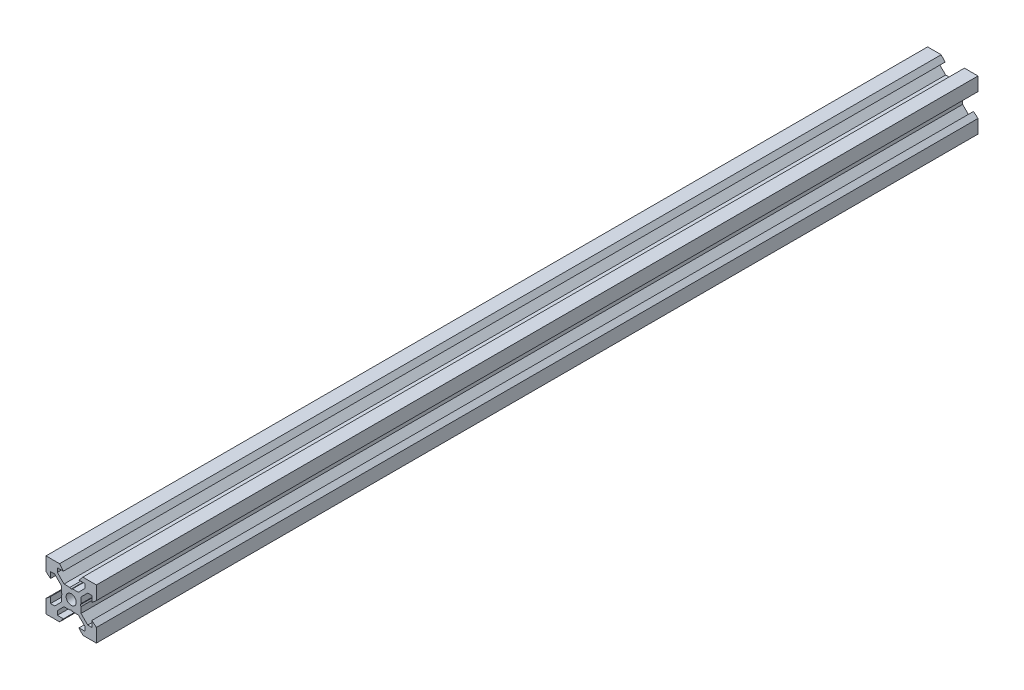
from build123d import *

# Parameters (mm, degrees)
SKETCH1_R           = 2
BOSS_EXTRUDE1_DEPTH = 175


with BuildPart() as part:
    # Sketch1 → Boss-Extrude1 (new, symmetric)
    with BuildSketch(Plane.XY):
        Polygon((10, 10), (10, 4.610379336), (8.2, 3.1), (8.2, 5.5), (6.560660172, 5.5), (3.9, 2.839339828), (3.9, 0.519615242), (3.6, 0), (3.9, -0.519615242), (3.9, -2.839339828), (6.560660172, -5.5), (8.2, -5.5), (8.2, -3.1), (10, -4.610379336), (10, -10), (4.610379336, -10), (3.1, -8.2), (5.5, -8.2), (5.5, -6.560660172), (2.839339828, -3.9), (0.519615242, -3.9), (0, -3.6), (-0.519615242, -3.9), (-2.839339828, -3.9), (-5.5, -6.560660172), (-5.5, -8.2), (-3.1, -8.2), (-4.610379336, -10), (-10, -10), (-10, -4.610379336), (-8.2, -3.1), (-8.2, -5.5), (-6.560660172, -5.5), (-3.9, -2.839339828), (-3.9, -0.519615242), (-3.6, 0), (-3.9, 0.519615242), (-3.9, 2.839339828), (-6.560660172, 5.5), (-8.2, 5.5), (-8.2, 3.1), (-10, 4.610379336), (-10, 10), (-4.610379336, 10), (-3.1, 8.2), (-5.5, 8.2), (-5.5, 6.560660172), (-2.839339828, 3.9), (-0.519615242, 3.9), (0, 3.6), (0.519615242, 3.9), (2.839339828, 3.9), (5.5, 6.560660172), (5.5, 8.2), (3.1, 8.2), (4.610379336, 10), align=None)
        Circle(SKETCH1_R, mode=Mode.SUBTRACT)
    extrude(amount=BOSS_EXTRUDE1_DEPTH, both=True)


solid = part.part
